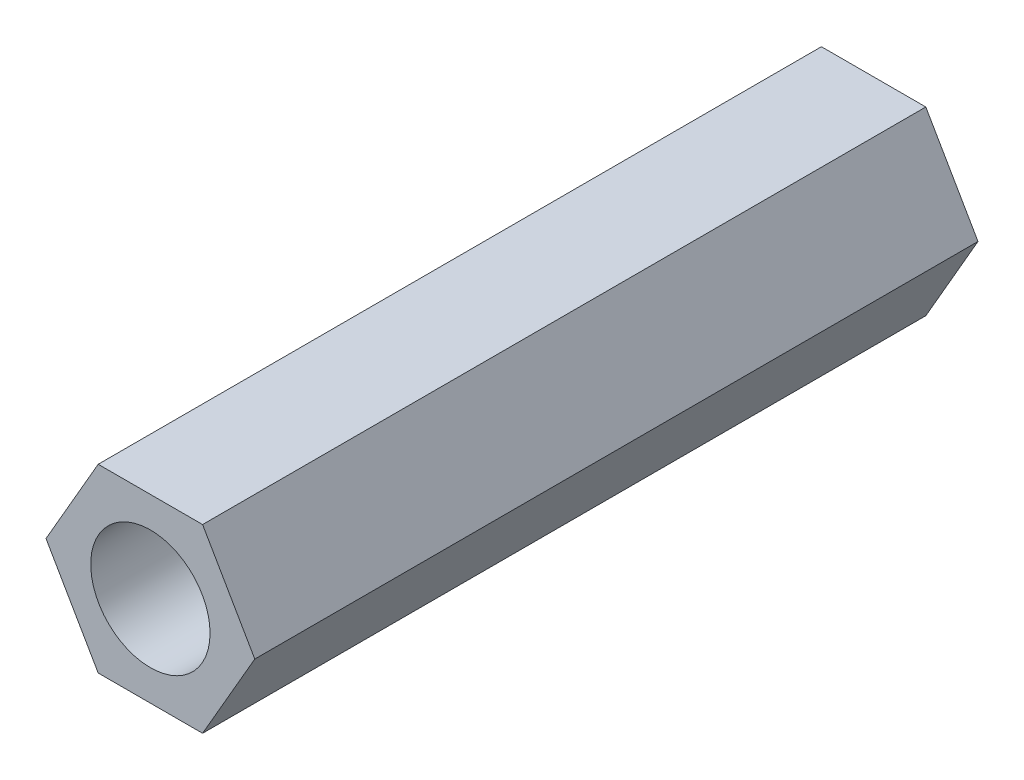
from build123d import *

# Parameters (mm, degrees)
SKETCH_1_R           = 1.65
F_20MM_M3_D3P3_DEPTH = 20


with BuildPart() as part:
    # 草图1 → 20mm铝柱_M3通孔_D3p3 (new body)
    with BuildSketch(Plane.XY):
        Polygon((2.886751346, 0), (1.443375673, 2.5), (-1.443375673, 2.5), (-2.886751346, 0), (-1.443375673, -2.5), (1.443375673, -2.5), align=None)
        Circle(SKETCH_1_R, mode=Mode.SUBTRACT)
    extrude(amount=F_20MM_M3_D3P3_DEPTH)


solid = part.part
